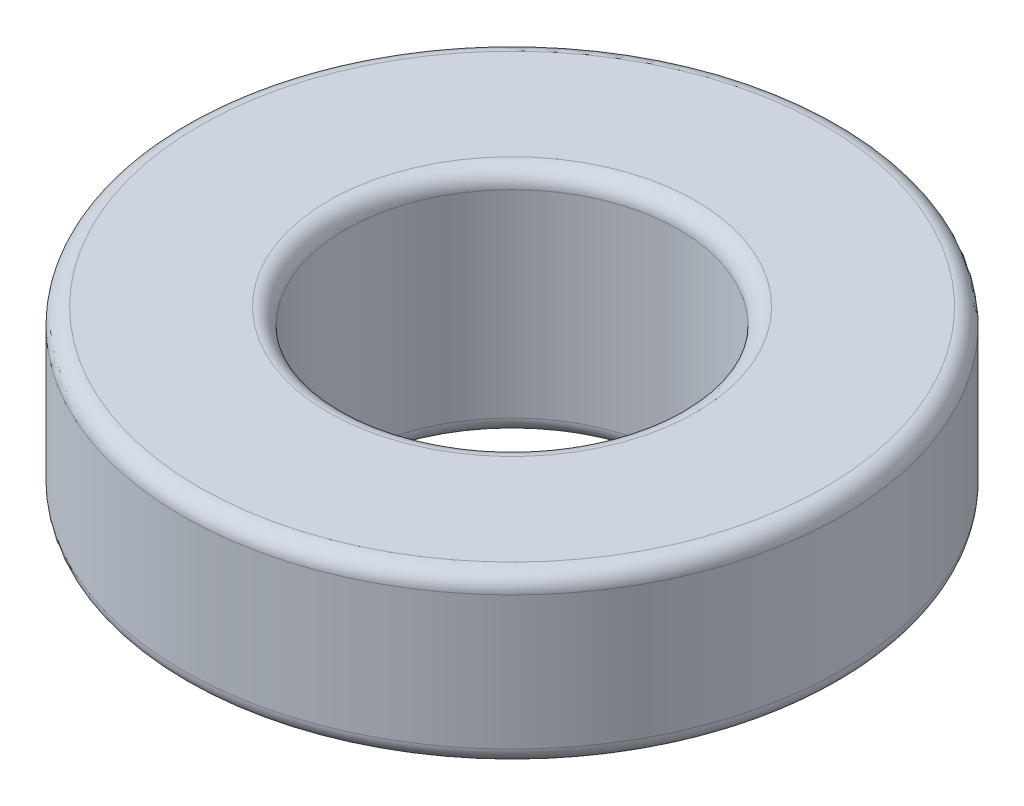
from build123d import *

# Parameters (mm, degrees)
SKETCH_1_R      = 2.69
SKETCH_1_R_2    = 2
EXTRUDE_1_DEPTH = 0.77
SKETCH_2_R      = 3.95
SKETCH_2_R_2    = 2
EXTRUDE_2_DEPTH = 2
FILLET_1_R      = 0.2


with BuildPart() as part:
    # 草图1 → 凸台-拉伸1 (new body)
    with BuildSketch(Plane(origin=(0, 0, 0), x_dir=(1, 0, 0), z_dir=(0, 1, 0))):
        with Locations(Location((0, 0, 0), (0, 0, 270))):
            Circle(SKETCH_1_R)
        with Locations(Location((0, 0, 0), (0, 0, 270))):
            Circle(SKETCH_1_R_2, mode=Mode.SUBTRACT)
    extrude(amount=EXTRUDE_1_DEPTH)

    # 草图2 → 凸台-拉伸2 (add)
    with BuildSketch(Plane(origin=(0, 0.77, 0), x_dir=(1, 0, 0), z_dir=(0, 1, 0))):
        with Locations(Location((0, 0, 0), (0, 0, 270))):
            Circle(SKETCH_2_R)
        with Locations(Location((0, 0, 0), (0, 0, 270))):
            Circle(SKETCH_2_R_2, mode=Mode.SUBTRACT)
    extrude(amount=EXTRUDE_2_DEPTH)

    # 圆角1
    fillet_1_edges = [part.edges().sort_by_distance(p)[0] for p in [
        (0, 0.77, -3.95),
        (0, 2.77, -2),
        (0, 0, -2),
        (0, 2.77, -3.95),
    ]]
    fillet(fillet_1_edges, radius=FILLET_1_R)


solid = part.part
